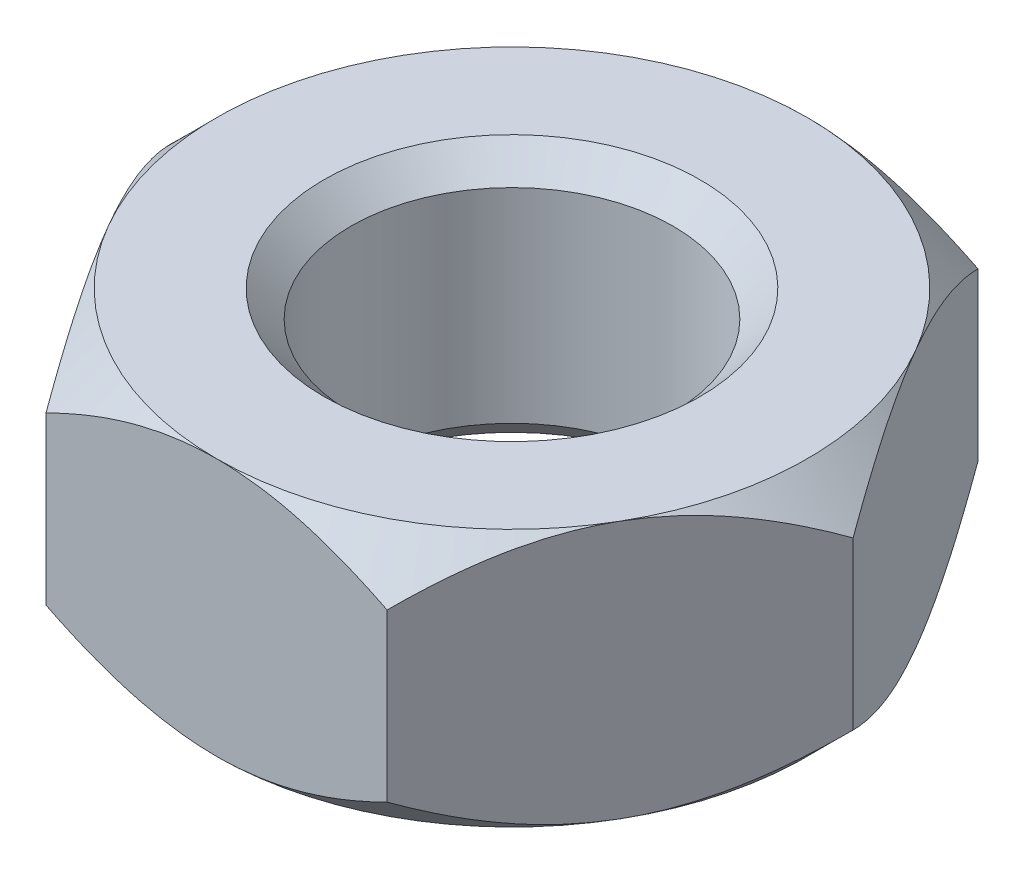
from build123d import *

# Parameters (mm, degrees)
SKETCH1_R           = 1.5
BOSS_EXTRUDE1_DEPTH = 2.4
CHAMFER2_SIZE       = 0.25


with BuildPart() as part:
    # Sketch1 → Boss-Extrude1 (new body)
    with BuildSketch(Plane(origin=(0, 0, 0), x_dir=(1, 0, 0), z_dir=(0, 1, 0))):
        Polygon((-1.58771324, -2.75), (1.58771324, -2.75), (3.175426481, 0), (1.58771324, 2.75), (-1.58771324, 2.75), (-3.175426481, 0), align=None)
        with Locations(Location((0, 0, 0), (0, 0, 270))):
            Circle(SKETCH1_R, mode=Mode.SUBTRACT)
    extrude(amount=BOSS_EXTRUDE1_DEPTH)

    # Sketch2 → Cut-Revolve1 (revolve, cut)
    with BuildSketch(Plane(origin=(0, 0, 0), x_dir=(0, 0, -1), z_dir=(1, 0, 0))):
        Polygon((2.75, 2.4), (3.8, 3.45), (3.8, 1.35), align=None)
        Polygon((3.8, 1.05), (2.75, 0), (3.8, -1.05), align=None)
    revolve(axis=Axis((0, 2.4, 0), (0, -1, 0)), mode=Mode.SUBTRACT)

    # Chamfer2
    chamfer2_edges = [part.edges().sort_by_distance(p)[0] for p in [
        (0, 0, -1.5),
        (0, 2.4, -1.5),
    ]]
    chamfer(chamfer2_edges, length=CHAMFER2_SIZE)


solid = part.part
